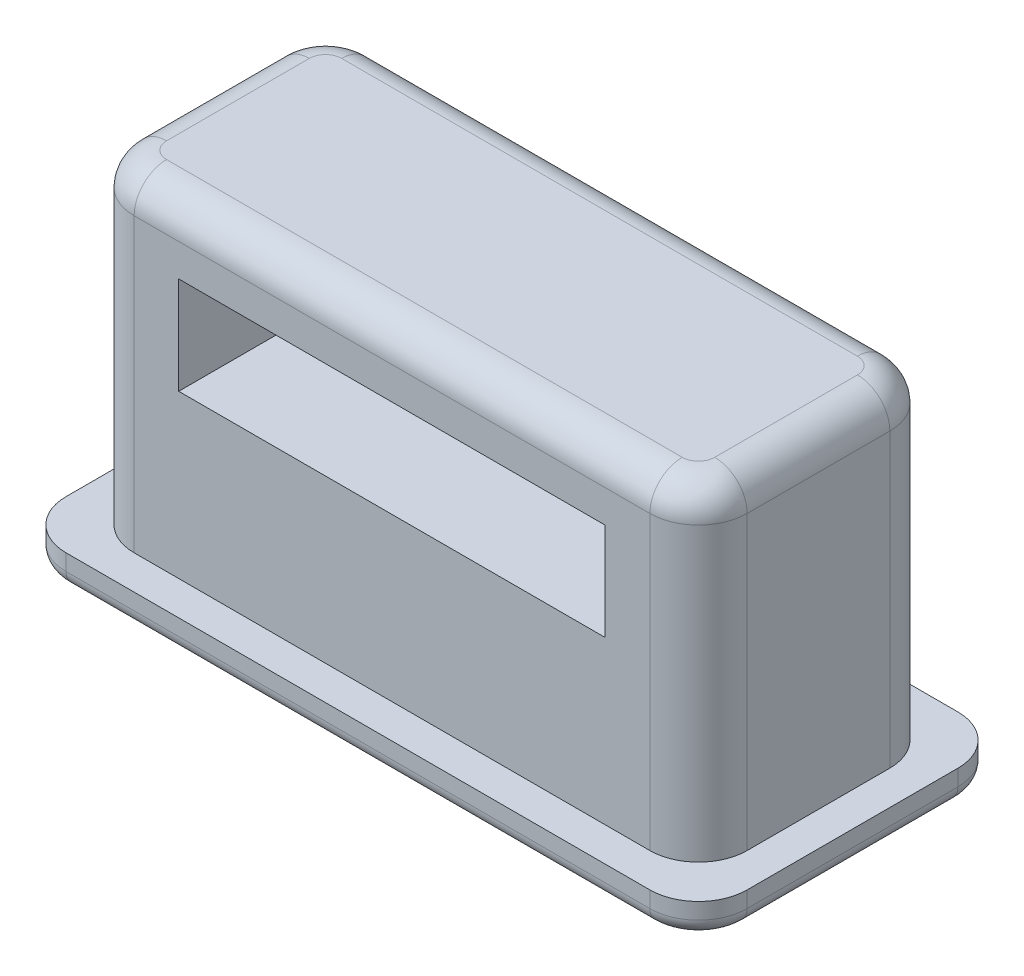
from build123d import *

# Parameters (mm, degrees)
SKETCH1_W           = 42
SKETCH1_H           = 19
BOSS_EXTRUDE1_DEPTH = 2
FILLET1_R           = 3
FILLET2_R           = 1
SKETCH2_W           = 37.8
SKETCH2_H           = 14.8
BOSS_EXTRUDE2_DEPTH = 10
SKETCH3_W           = 5.75
SKETCH3_H           = 14.8
BOSS_EXTRUDE3_DEPTH = 10
SKETCH5_W           = 14.8
SKETCH5_H           = 4
BOSS_EXTRUDE4_DEPTH = 26.3
FILLET4_R           = 3
FILLET5_R           = 2


with BuildPart() as part:
    # Sketch1 → Boss-Extrude1 (new body)
    with BuildSketch(Plane(origin=(0, 0, 0), x_dir=(1, 0, 0), z_dir=(0, 1, 0))):
        with Locations((-35.747676634, 5.960595817)):
            Rectangle(SKETCH1_W, SKETCH1_H)
    extrude(amount=BOSS_EXTRUDE1_DEPTH)

    # Fillet1
    fillet1_edges = [part.edges().sort_by_distance(p)[0] for p in [
        (-56.747676634, 1, -15.460595817),
        (-14.747676634, 1, -15.460595817),
        (-14.747676634, 1, 3.539404183),
        (-56.747676634, 1, 3.539404183),
    ]]
    fillet(fillet1_edges, radius=FILLET1_R)

    # Fillet2
    fillet2_edges = [part.edges().sort_by_distance(p)[0] for p in [
        (-56.747676634, 0, -5.960595817),
        (-35.747676634, 0, -15.460595817),
        (-14.747676634, 0, -5.960595817),
        (-35.747676634, 0, 3.539404183),
        (-15.62635629, 0, 2.660724527),
        (-15.62635629, 0, -14.58191616),
        (-55.868996977, 0, 2.660724527),
        (-55.868996977, 0, -14.58191616),
    ]]
    fillet(fillet2_edges, radius=FILLET2_R)

    # Sketch2 → Boss-Extrude2 (add)
    with BuildSketch(Plane(origin=(0, 2, 0), x_dir=(1, 0, 0), z_dir=(0, 1, 0))):
        with Locations((-35.747676634, 5.960595817)):
            Rectangle(SKETCH2_W, SKETCH2_H)
    extrude(amount=BOSS_EXTRUDE2_DEPTH)

    # Sketch3 → Boss-Extrude3 (add)
    with BuildSketch(Plane(origin=(0, 12, 0), x_dir=(1, 0, 0), z_dir=(0, 1, 0))):
        with Locations((-19.722676634, 5.960595817)):
            Rectangle(SKETCH3_W, SKETCH3_H)
        with Locations((-51.772676634, 5.960595817)):
            Rectangle(SKETCH3_W, SKETCH3_H)
    extrude(amount=BOSS_EXTRUDE3_DEPTH)

    # Sketch5 → Boss-Extrude4 (add)
    with BuildSketch(Plane(origin=(-48.897676634, 0, 0), x_dir=(0, 0, -1), z_dir=(1, 0, 0))):
        with Locations((5.960595817, 20)):
            Rectangle(SKETCH5_W, SKETCH5_H)
    extrude(amount=BOSS_EXTRUDE4_DEPTH)

    # Fillet4
    fillet4_edges = [part.edges().sort_by_distance(p)[0] for p in [
        (-54.647676634, 12, -13.360595817),
        (-54.647676634, 12, 1.439404183),
        (-16.847676634, 12, 1.439404183),
        (-16.847676634, 12, -13.360595817),
    ]]
    fillet(fillet4_edges, radius=FILLET4_R)

    # Fillet5
    fillet5_edges = [part.edges().sort_by_distance(p)[0] for p in [
        (-35.747676634, 22, -13.360595817),
        (-16.847676634, 22, -5.960595817),
        (-35.747676634, 22, 1.439404183),
        (-54.647676634, 22, -5.960595817),
        (-53.768996977, 22, 0.560724527),
        (-53.768996977, 22, -12.48191616),
        (-17.72635629, 22, 0.560724527),
        (-17.72635629, 22, -12.48191616),
    ]]
    fillet(fillet5_edges, radius=FILLET5_R)


solid = part.part
